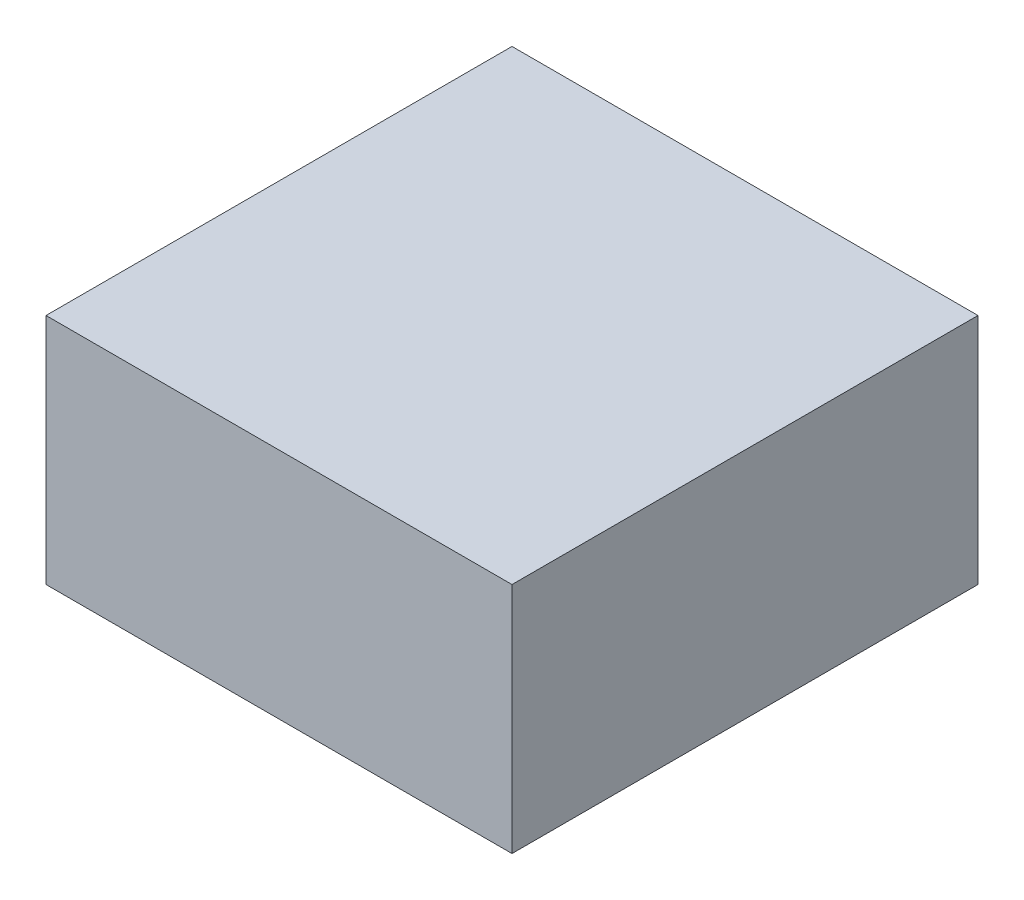
from build123d import *

# Parameters (mm, degrees)
SKETCH1_W           = 56
SKETCH1_H           = 56
BOSS_EXTRUDE1_DEPTH = 28


with BuildPart() as part:
    # Sketch1 → Boss-Extrude1 (new body)
    with BuildSketch(Plane(origin=(0, 0, 0), x_dir=(1, 0, 0), z_dir=(0, 1, 0))):
        Rectangle(SKETCH1_W, SKETCH1_H)
    extrude(amount=BOSS_EXTRUDE1_DEPTH)


solid = part.part
